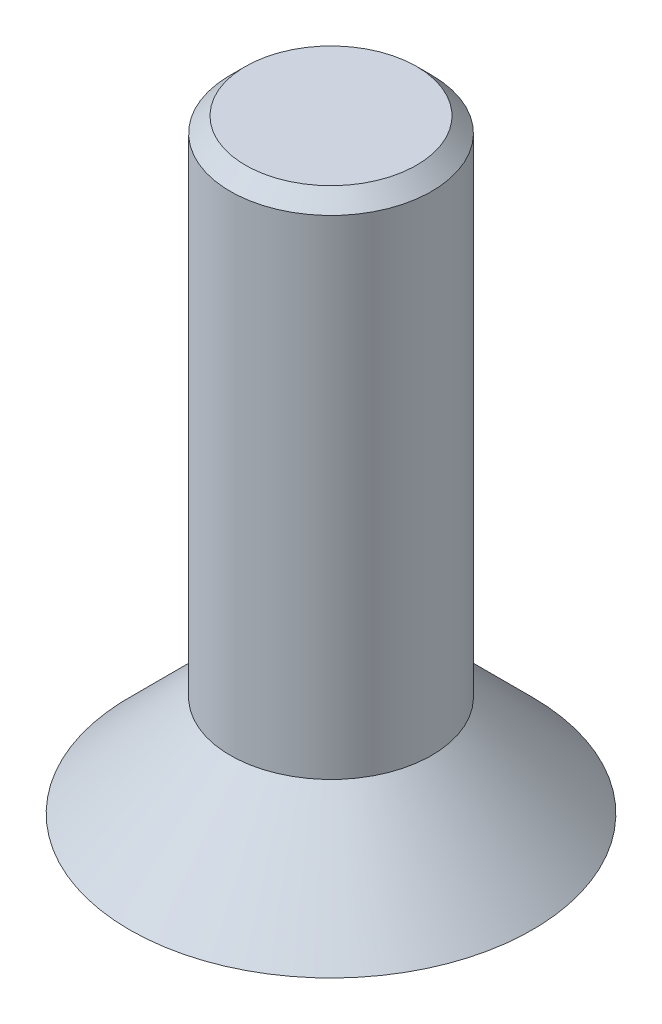
from build123d import *

# Parameters (mm, degrees)
CUT_EXTRUDE_316_DEPTH = 1.5


with BuildPart() as part:
    # Sketch 184 → Revolve 217 (revolve)
    with BuildSketch(Plane.XY, mode=Mode.PRIVATE) as revolve_217_sk:
        Polygon((0, 0), (4, 0), (2, 2), (2, 11.7), (1.7, 12), (0, 12), align=None)
    revolve(revolve_217_sk.sketch.rotate(Axis((0, -2, 0), (0, 1, 0)), 90), axis=Axis((0, -2, 0), (0, 1, 0)))

    # Sketch 268 → Cut-Extrude 316 (cut)
    with BuildSketch(Plane.XZ):
        Polygon((1.443375673, 0), (0.721687836, 1.25), (-0.721687836, 1.25), (-1.443375673, 0), (-0.721687836, -1.25), (0.721687836, -1.25), align=None)
    extrude(amount=-CUT_EXTRUDE_316_DEPTH, mode=Mode.SUBTRACT)


solid = part.part
